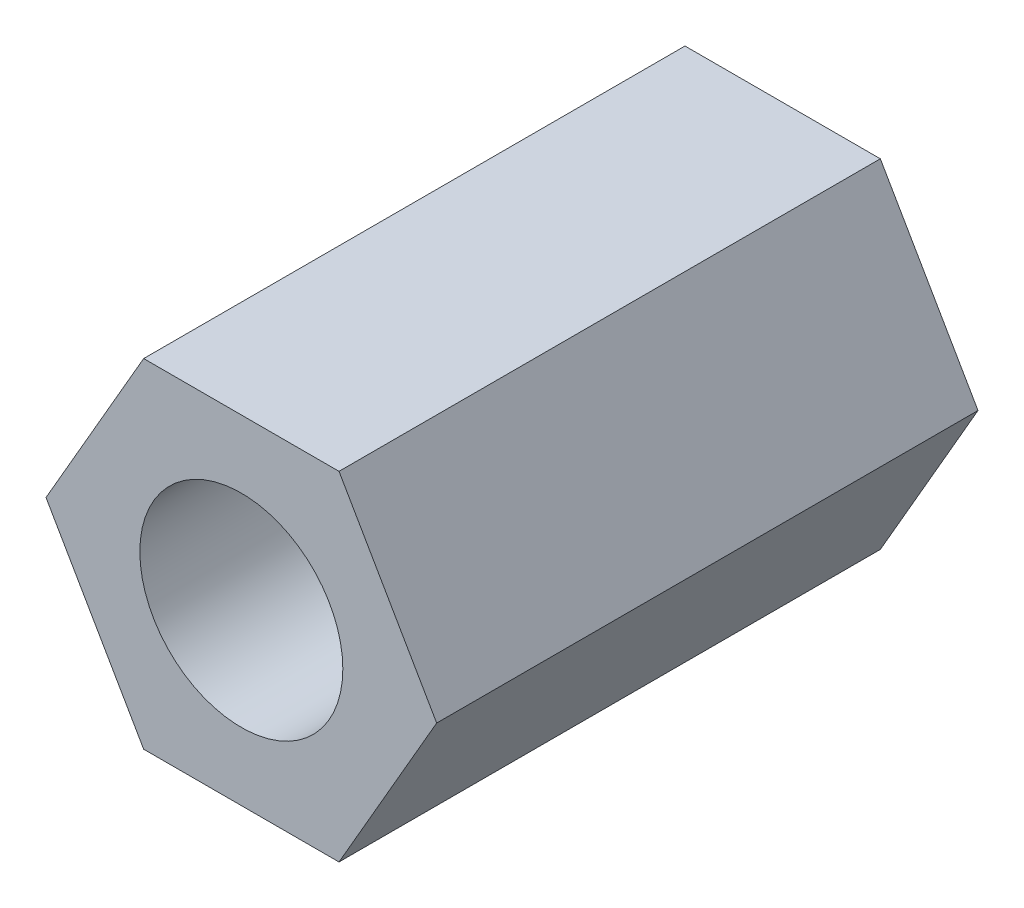
from build123d import *

# Parameters (mm, degrees)
ESQUISSE1_R        = 1.5
BOSS_EXTRU_1_DEPTH = 8


with BuildPart() as part:
    # Esquisse1 → Boss.-Extru.1 (new body)
    with BuildSketch(Plane.XY):
        Polygon((-2.886751346, 0), (-1.443375673, -2.5), (1.443375673, -2.5), (2.886751346, 0), (1.443375673, 2.5), (-1.443375673, 2.5), align=None)
        Circle(ESQUISSE1_R, mode=Mode.SUBTRACT)
    extrude(amount=BOSS_EXTRU_1_DEPTH)


solid = part.part
